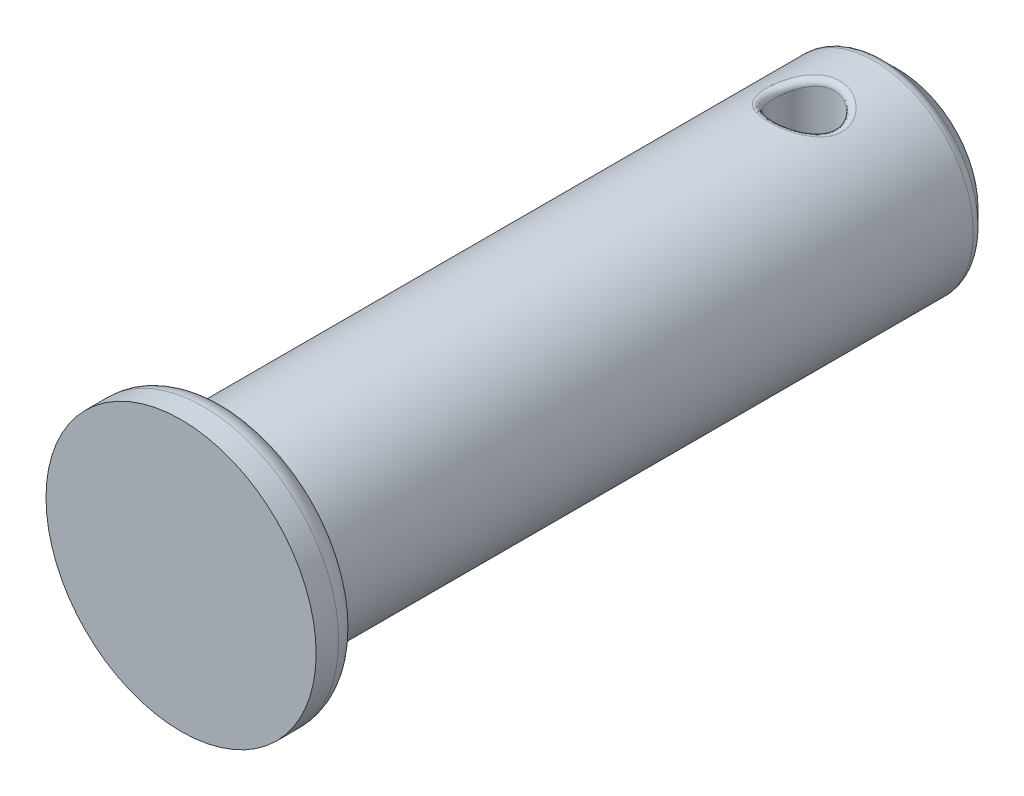
from build123d import *

# Parameters (mm, degrees)
SKETCH1_R               = 3.4925
BOSS_EXTRUDE1_DEPTH     = 23.8125
SKETCH2_R               = 4.7625
BOSS_EXTRUDE2_DEPTH     = 1.5875
CUT_EXTRUDE1_DEPTH      = 27.277800755
CUT_EXTRUDE1_DEPTH_BACK = 27.277800755
SKETCH3_R               = 1.058333333
FILLET1_R               = 0.1984375
FILLET3_R               = 0.79375
CHAMFER1_SIZE           = 0.79375
FILLET4_R               = 0.396875


with BuildPart() as part:
    # Sketch1 → Boss-Extrude1 (new body)
    with BuildSketch(Plane.XY):
        Circle(SKETCH1_R)
    extrude(amount=BOSS_EXTRUDE1_DEPTH)

    # Sketch2 → Boss-Extrude2 (add)
    with BuildSketch(Plane.XY.offset(23.8125)):
        Circle(SKETCH2_R)
    extrude(amount=BOSS_EXTRUDE2_DEPTH)

    # Sketch3 → Cut-Extrude1 (cut, two sides: drawn at the far end of the back side and taken through both)
    with BuildSketch(Plane(origin=(0, 0, 0), x_dir=(1, 0, 0), z_dir=(0, 1, 0)).offset(-CUT_EXTRUDE1_DEPTH_BACK)):
        with Locations(Location((0, -3.429, 0), (0, 0, 270))):
            Circle(SKETCH3_R)
    extrude(amount=CUT_EXTRUDE1_DEPTH + CUT_EXTRUDE1_DEPTH_BACK, mode=Mode.SUBTRACT)

    # Fillet1
    fillet1_edges = [part.edges().sort_by_distance(p)[0] for p in [
        (0, 3.492500015, 2.370666678),
        (0, -3.492500015, 2.370666678),
    ]]
    fillet(fillet1_edges, radius=FILLET1_R)

    # Fillet3
    fillet3_edges = [part.edges().sort_by_distance(p)[0] for p in [
        (-4.7625, 0, 23.8125),
    ]]
    fillet(fillet3_edges, radius=FILLET3_R)

    # Chamfer1
    chamfer1_edges = [part.edges().sort_by_distance(p)[0] for p in [
        (-3.4925, 0, 0),
    ]]
    chamfer(chamfer1_edges, length=CHAMFER1_SIZE)

    # Fillet4
    fillet4_edges = [part.edges().sort_by_distance(p)[0] for p in [
        (-3.4925, 0, 0.79375),
        (-2.69875, 0, 0),
    ]]
    fillet(fillet4_edges, radius=FILLET4_R)


solid = part.part
